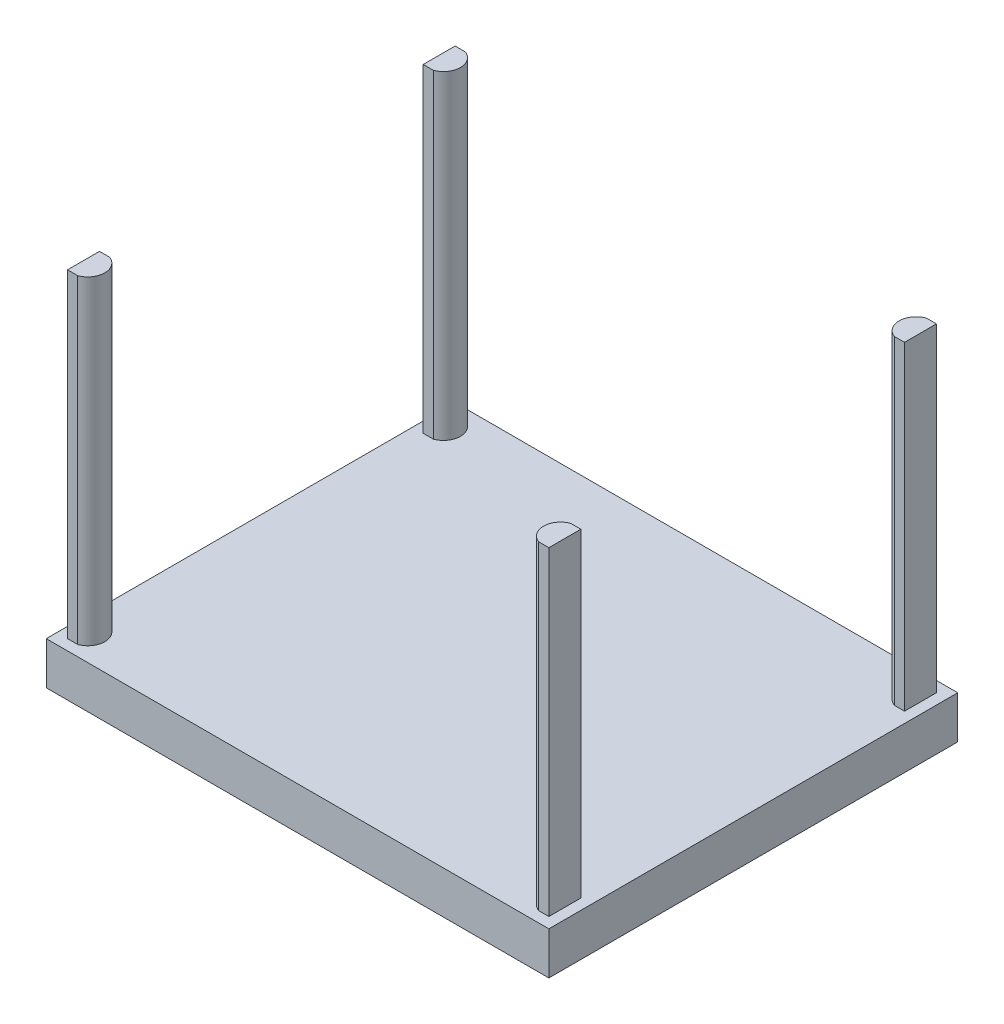
from build123d import *

# Parameters (mm, degrees)
SCHIZZO2_W                   = 118
SCHIZZO2_H                   = 96
ESTRUSIONE_ESTRUSIONE1_DEPTH = 20
ESTRUSIONE_ESTRUSIONE2_DEPTH = 170


with BuildPart() as part:
    # Schizzo2 → Estrusione-Estrusione1 (new body)
    with BuildSketch(Plane(origin=(0, 0, 0), x_dir=(1, 0, 0), z_dir=(0, 1, 0))):
        Rectangle(SCHIZZO2_W, SCHIZZO2_H)
    extrude(amount=ESTRUSIONE_ESTRUSIONE1_DEPTH)

    # Schizzo3 → Estrusione-Estrusione2 (add)
    with BuildSketch(Plane(origin=(0, 0, 0), x_dir=(1, 0, 0), z_dir=(0, 1, 0))):
        with BuildLine():
            Line((-49.216117819, 28), (-54, 28))
            Line((-54, 28), (-54, 43))
            Line((-54, 43), (-49.216117819, 43))
            ThreePointArc((-49.216117819, 43), (-44, 35.5), (-49.216117819, 28))
        make_face()
    extrude(amount=ESTRUSIONE_ESTRUSIONE2_DEPTH)

    # Specchia3: part across plane


with BuildPart() as part_1:
    add(part.part)
    add(part.part.mirror(Plane(origin=(-59, 20, 48), x_dir=(1, 0, 0), z_dir=(0, 0, -1))))

    # Specchia2: part across plane


with BuildPart() as part_2:
    add(part_1.part)
    add(part_1.part.mirror(Plane(origin=(59, 20, -48), x_dir=(0, 0, 1), z_dir=(-1, 0, 0))))


solid = part_2.part
